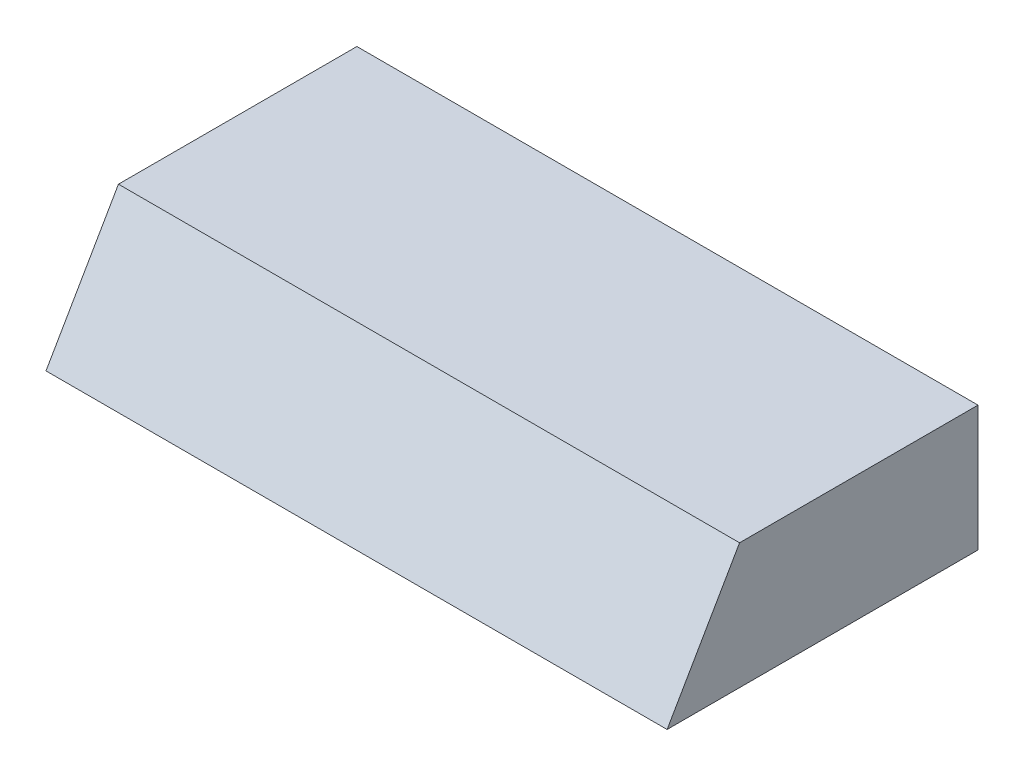
from build123d import *

# Parameters (mm, degrees)
BOSS_EXTRUDE1_DEPTH = 198
SHELL1_T            = -7
BOSS_EXTRUDE2_DEPTH = 191
SKETCH3_W           = 95.245639834
SKETCH3_H           = 3
BOSS_EXTRUDE3_DEPTH = 191
SKETCH4_R           = 1.585
CUT_EXTRUDE1_DEPTH  = 5
BOSS_EXTRUDE4_DEPTH = 25


with BuildPart() as part:
    # Sketch1 → Boss-Extrude1 (new body)
    with BuildSketch(Plane(origin=(0, 0, 0), x_dir=(0, 0, -1), z_dir=(1, 0, 0))):
        Polygon((22.10846405, 0), (32.441807929, 17.899216821), (45.200737204, 39.99998538), (121.214199537, 39.99998538), (121.18, 0), align=None)
    extrude(amount=BOSS_EXTRUDE1_DEPTH)

    # Shell1
    shell1_openings = [part.faces().sort_by_distance(p)[0] for p in [
        (99, 0, -71.644232025),
    ]]
    offset(amount=SHELL1_T, openings=shell1_openings, kind=Kind.INTERSECTION)

    # Sketch2 → Boss-Extrude2 (add)
    with BuildSketch(Plane.ZY):
        Polygon((-30.191216521, 0), (-32.974854852, 0), (-52.025978727, 32.99998538), (-49.242340395, 32.99998538), align=None)
    extrude(amount=-BOSS_EXTRUDE2_DEPTH)

    # Sketch3 → Boss-Extrude3 (add)
    with BuildSketch(Plane.ZY):
        with Locations((-73.557180083, 1.5)):
            Rectangle(SKETCH3_W, SKETCH3_H)
    extrude(amount=-BOSS_EXTRUDE3_DEPTH)

    # Sketch4 → Cut-Extrude1 (cut)
    with BuildSketch(Plane(origin=(0, 3, 0), x_dir=(1, 0, 0), z_dir=(0, 1, 0))):
        with Locations(Location((11, 109.182562408, 0), (0, 0, 270))):
            Circle(SKETCH4_R)
        with Locations(Location((11, 39.706775972, 0), (0, 0, 270))):
            Circle(SKETCH4_R)
    cut_extrude1 = extrude(amount=-CUT_EXTRUDE1_DEPTH, mode=Mode.SUBTRACT)

    # Mirror1: Cut-Extrude1 across plane
    add(cut_extrude1.mirror(Plane(origin=(99, 0, 0), x_dir=(0, 0, 1), z_dir=(1, 0, 0))), mode=Mode.SUBTRACT)

    # Sketch5 → Boss-Extrude4 (add)
    with BuildSketch(Plane(origin=(0, 3, 0), x_dir=(1, 0, 0), z_dir=(0, 1, 0))):
        Polygon((187.246573538, 56.499587918), (77.246576653, 56.473406784), (77.260934082, 91.473403839), (187.260930967, 91.499584973), align=None)
    extrude(amount=BOSS_EXTRUDE4_DEPTH)


solid = part.part
